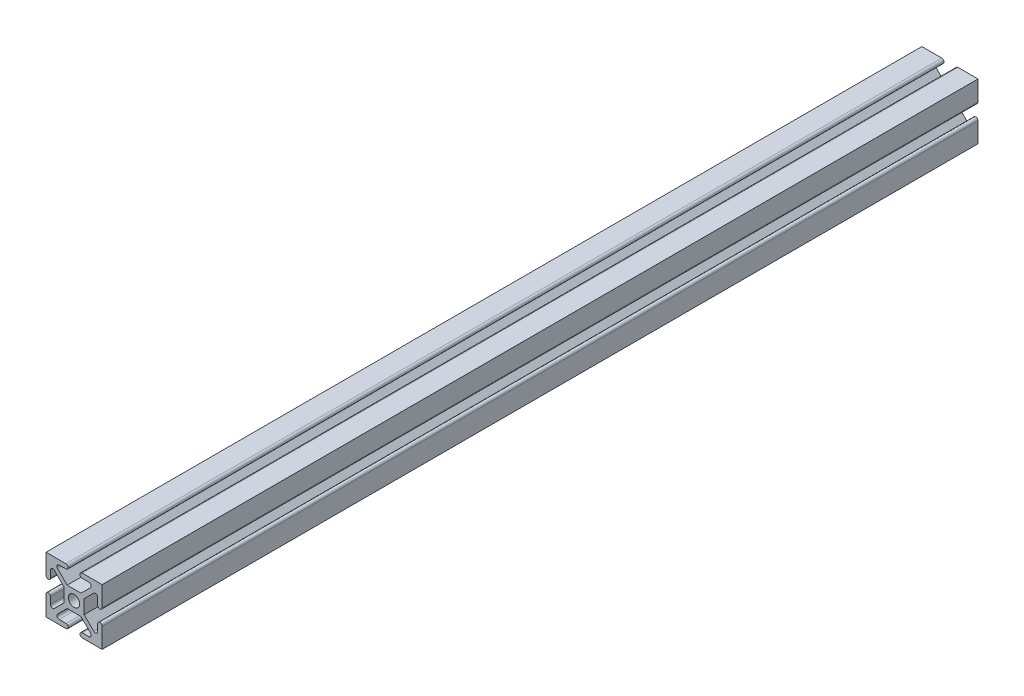
from build123d import *

# Parameters (mm, degrees)
SKETCH2_R           = 2.5
BOSS_EXTRUDE1_DEPTH = 390


with BuildPart() as part:
    # Sketch2 → Boss-Extrude1 (new body)
    with BuildSketch(Plane.XY):
        with BuildLine():
            ThreePointArc((16.100505063, 0), (15.100505063, 1), (16.100505063, 2))
            Line((16.100505063, 2), (19.100505063, 2))
            ThreePointArc((19.100505063, 2), (20.05158107, 2.635488671), (19.828427125, 3.757359313))
            Line((19.828427125, 3.757359313), (15.585786438, 8))
            Line((15.585786438, 8), (12.5, 8))
            Line((12.5, 8), (9.414213562, 8))
            Line((9.414213562, 8), (5.171572875, 3.757359313))
            ThreePointArc((5.171572875, 3.757359313), (4.94841893, 2.635488671), (5.899494937, 2))
            Line((5.899494937, 2), (8.899494937, 2))
            ThreePointArc((8.899494937, 2), (9.899494937, 1), (8.899494937, 0))
            Line((8.899494937, 0), (0, 0))
            Line((0, 0), (0, 8.899494937))
            ThreePointArc((0, 8.899494937), (1, 9.899494937), (2, 8.899494937))
            Line((2, 8.899494937), (2, 5.899494937))
            ThreePointArc((2, 5.899494937), (2.635488671, 4.94841893), (3.757359313, 5.171572875))
            Line((3.757359313, 5.171572875), (8, 9.414213562))
            Line((8, 9.414213562), (8, 12.5))
            Line((8, 12.5), (8, 15.585786438))
            Line((8, 15.585786438), (3.757359313, 19.828427125))
            ThreePointArc((3.757359313, 19.828427125), (2.635488671, 20.05158107), (2, 19.100505063))
            Line((2, 19.100505063), (2, 16.100505063))
            ThreePointArc((2, 16.100505063), (1, 15.100505063), (0, 16.100505063))
            Line((0, 16.100505063), (0, 25))
            Line((0, 25), (8.899494937, 25))
            ThreePointArc((8.899494937, 25), (9.899494937, 24), (8.899494937, 23))
            Line((8.899494937, 23), (5.899494937, 23))
            ThreePointArc((5.899494937, 23), (4.94841893, 22.364511329), (5.171572875, 21.242640687))
            Line((5.171572875, 21.242640687), (9.414213562, 17))
            Line((9.414213562, 17), (12.5, 17))
            Line((12.5, 17), (15.585786438, 17))
            Line((15.585786438, 17), (19.828427125, 21.242640687))
            ThreePointArc((19.828427125, 21.242640687), (20.05158107, 22.364511329), (19.100505063, 23))
            Line((19.100505063, 23), (16.100505063, 23))
            ThreePointArc((16.100505063, 23), (15.100505063, 24), (16.100505063, 25))
            Line((16.100505063, 25), (25, 25))
            Line((25, 25), (25, 16.100505063))
            ThreePointArc((25, 16.100505063), (24, 15.100505063), (23, 16.100505063))
            Line((23, 16.100505063), (23, 19.100505063))
            ThreePointArc((23, 19.100505063), (22.364511329, 20.05158107), (21.242640687, 19.828427125))
            Line((21.242640687, 19.828427125), (17, 15.585786438))
            Line((17, 15.585786438), (17, 12.5))
            Line((17, 12.5), (17, 9.414213562))
            Line((17, 9.414213562), (21.242640687, 5.171572875))
            ThreePointArc((21.242640687, 5.171572875), (22.364511329, 4.94841893), (23, 5.899494937))
            Line((23, 5.899494937), (23, 8.899494937))
            ThreePointArc((23, 8.899494937), (24, 9.899494937), (25, 8.899494937))
            Line((25, 8.899494937), (25, 0))
            Line((25, 0), (16.100505063, 0))
        make_face()
        with Locations((12.5, 12.5)):
            Circle(SKETCH2_R, mode=Mode.SUBTRACT)
    extrude(amount=BOSS_EXTRUDE1_DEPTH)


solid = part.part
